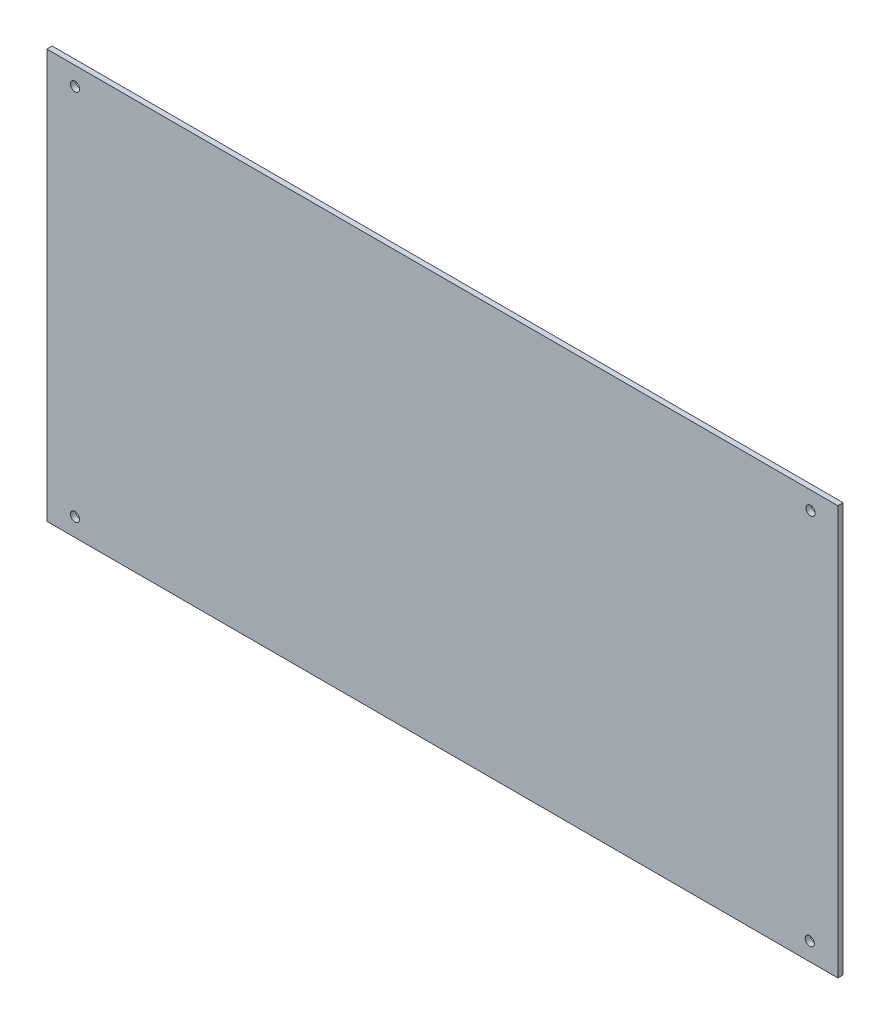
from build123d import *

# Parameters (mm, degrees)
ESQUISSE1_W             = 450.3
ESQUISSE1_H             = 232.85
BOSS_EXTRU_1_DEPTH      = 3
ESQUISSE2_R             = 2.6
ENL_V_MAT_EXTRU_1_DEPTH = 20


with BuildPart() as part:
    # Esquisse1 → Boss.-Extru.1 (new body)
    with BuildSketch(Plane.XY):
        with Locations((-225.15, 116.425)):
            Rectangle(ESQUISSE1_W, ESQUISSE1_H)
    extrude(amount=BOSS_EXTRU_1_DEPTH)

    # Esquisse2 → Enlèv. mat.-Extru.1 (cut)
    with BuildSketch(Plane.XY.offset(3)):
        with Locations((-434.3, 10.236797306)):
            Circle(ESQUISSE2_R)
        with Locations((-16, 10.236797306)):
            Circle(ESQUISSE2_R)
        with Locations((-15.549028202, 222.672231983)):
            Circle(ESQUISSE2_R)
        with Locations((-434.3, 222.387328548)):
            Circle(ESQUISSE2_R)
    extrude(amount=-ENL_V_MAT_EXTRU_1_DEPTH, mode=Mode.SUBTRACT)


solid = part.part
